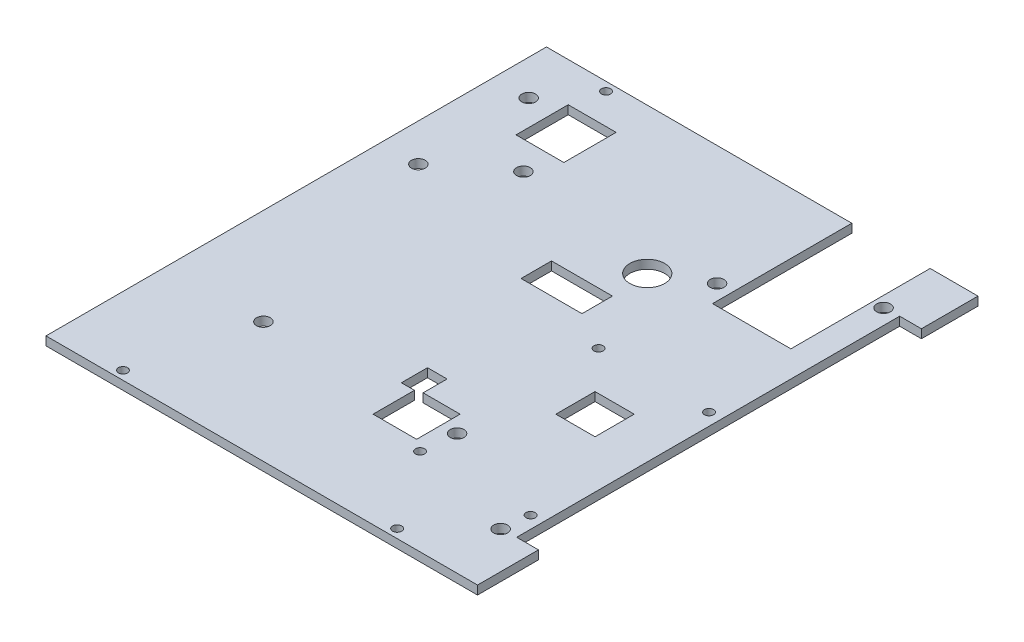
from build123d import *

# Parameters (mm, degrees)
SKETCH_1_R      = 1.05
SKETCH_1_R_2    = 1.585
SKETCH_1_W      = 9
SKETCH_1_H      = 9
SKETCH_1_W_2    = 11
SKETCH_1_H_2    = 12
SKETCH_1_W_3    = 14
SKETCH_1_H_3    = 7
SKETCH_1_R_3    = 4
EXTRUDE_1_DEPTH = 2


with BuildPart() as part:
    # 草图1 → 凸台-拉伸1 (new body)
    with BuildSketch(Plane(origin=(0, 0, 0), x_dir=(1, 0, 0), z_dir=(0, 1, 0))):
        Polygon((70.16, 0), (0, 0), (0, -115), (99.16, -115), (99.16, -101), (94.16, -101), (94.16, -13), (99.16, -13), (99.16, 0), (88.16, 0), (88.16, -32), (70.16, -32), align=None)
        with Locations(Location((15.69, -113, 0), (0, 0, 270))):
            Circle(SKETCH_1_R, mode=Mode.SUBTRACT)
        with Locations(Location((22.16, -87.2, 0), (0, 0, 270))):
            Circle(SKETCH_1_R_2, mode=Mode.SUBTRACT)
        with Locations(Location((65.96, -95, 0), (0, 0, 270))):
            Circle(SKETCH_1_R, mode=Mode.SUBTRACT)
        with Locations(Location((66.66, -87.2, 0), (0, 0, 270))):
            Circle(SKETCH_1_R_2, mode=Mode.SUBTRACT)
        with Locations(Location((78.69, -113, 0), (0, 0, 270))):
            Circle(SKETCH_1_R, mode=Mode.SUBTRACT)
        with Locations(Location((90.66, -101.2, 0), (0, 0, 270))):
            Circle(SKETCH_1_R_2, mode=Mode.SUBTRACT)
        with Locations(Location((91.36, -95, 0), (0, 0, 270))):
            Circle(SKETCH_1_R, mode=Mode.SUBTRACT)
        Polygon((50.16, -83.5), (50.16, -77.5), (54.66, -77.5), (54.66, -83), (63.16, -83), (63.16, -93), (53.16, -93), (53.16, -83.5), align=None, mode=Mode.SUBTRACT)
        with Locations((78.66, -67.5)):
            Rectangle(SKETCH_1_W, SKETCH_1_H, mode=Mode.SUBTRACT)
        with Locations(Location((22.16, -27.46, 0), (0, 0, 270))):
            Circle(SKETCH_1_R_2, mode=Mode.SUBTRACT)
        with Locations((19.5, -15)):
            Rectangle(SKETCH_1_W_2, SKETCH_1_H_2, mode=Mode.SUBTRACT)
        with Locations(Location((15.69, -2, 0), (0, 0, 270))):
            Circle(SKETCH_1_R, mode=Mode.SUBTRACT)
        with Locations((50.16, -45.5)):
            Rectangle(SKETCH_1_W_3, SKETCH_1_H_3, mode=Mode.SUBTRACT)
        with Locations(Location((65.96, -54, 0), (0, 0, 270))):
            Circle(SKETCH_1_R, mode=Mode.SUBTRACT)
        with Locations(Location((56.66, -33.5, 0), (0, 0, 270))):
            Circle(SKETCH_1_R_3, mode=Mode.SUBTRACT)
        with Locations(Location((91.36, -54, 0), (0, 0, 270))):
            Circle(SKETCH_1_R, mode=Mode.SUBTRACT)
        with Locations(Location((66.66, -27.46, 0), (0, 0, 270))):
            Circle(SKETCH_1_R_2, mode=Mode.SUBTRACT)
        with Locations(Location((90.66, -13.2, 0), (0, 0, 270))):
            Circle(SKETCH_1_R_2, mode=Mode.SUBTRACT)
        with Locations(Location((8.12, -12.2, 0), (0, 0, 270))):
            Circle(SKETCH_1_R_2, mode=Mode.SUBTRACT)
        with Locations(Location((8.62, -38.06, 0), (0, 0, 270))):
            Circle(SKETCH_1_R_2, mode=Mode.SUBTRACT)
    extrude(amount=EXTRUDE_1_DEPTH)


solid = part.part
